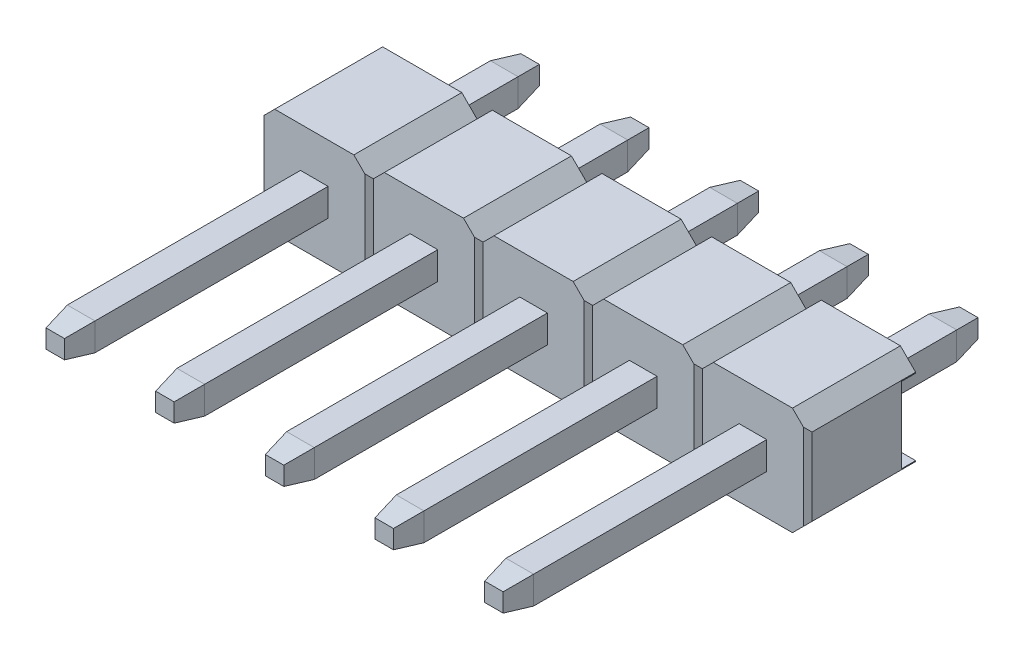
from build123d import *
from OCP.BRepFilletAPI import BRepFilletAPI_MakeChamfer

# Parameters (mm, degrees)
EXTRUDE1_DEPTH          = 1.25
CUT_EXTRUDE3_DEPTH      = 3.176671771
LPATTERN4_COUNT         = 5
LPATTERN4_PITCH         = 2.54
CUT_EXTRUDE1_DEPTH      = 12.565893826
CUT_EXTRUDE1_DEPTH_BACK = 12.565893826
SKETCH2_W               = 1.752893218
SKETCH2_H               = 0.33
SKETCH3_W               = 11
SKETCH3_H               = 0.64
EXTRUDE_THIN1_DEPTH     = 0.32
LPATTERN5_COUNT         = 5
LPATTERN5_PITCH         = 2.54
CHAMFER2_SIZE           = 0.6
CHAMFER2_SIZE2          = 0.105796188


with BuildPart() as part:
    # Sketch1 → Extrude1 (new, symmetric)
    with BuildSketch(Plane.XY):
        Polygon((-1.27, 0.896446609), (-0.916446609, 1.25), (0.916446609, 1.25), (1.27, 0.896446609), (1.27, -0.896446609), (0.916446609, -1.25), (-0.916446609, -1.25), (-1.27, -0.896446609), align=None)
    extrude1 = extrude(amount=EXTRUDE1_DEPTH, both=True)

    # Sketch4 → Cut-Extrude3 (cut, symmetric)
    with BuildSketch(Plane(origin=(0, 0, 0), x_dir=(1, 0, 0), z_dir=(0, 1, 0))):
        Polygon((-1.27, -1.15), (-1.17, -1.25), (-1.27, -1.25), align=None)
        Polygon((1.17, -1.25), (1.27, -1.15), (1.27, -1.25), align=None)
    cut_extrude3 = extrude(amount=CUT_EXTRUDE3_DEPTH, both=True, mode=Mode.SUBTRACT)

    # LPattern4: Extrude1, Cut-Extrude3 ×5
    with Locations(*[(-i * LPATTERN4_PITCH, 0, 0) for i in range(1, LPATTERN4_COUNT)]):
        add(extrude1)
        add(cut_extrude3, mode=Mode.SUBTRACT)

    # Sketch2 → Cut-Extrude1 (cut, two sides: drawn at the far end of the back side and taken through both)
    with BuildSketch(Plane(origin=(0, 0, 0), x_dir=(0, -1, 0), z_dir=(1, 0, 0)).offset(-CUT_EXTRUDE1_DEPTH_BACK)):
        with Locations((0, 1.085)):
            Rectangle(SKETCH2_W, SKETCH2_H)
    extrude(amount=CUT_EXTRUDE1_DEPTH + CUT_EXTRUDE1_DEPTH_BACK, mode=Mode.SUBTRACT)

    # Sketch3 → Extrude-Thin1 (add, symmetric)
    with BuildSketch(Plane(origin=(0, 0, 0), x_dir=(0, 0, -1), z_dir=(1, 0, 0))):
        with Locations((-1.75, 0)):
            Rectangle(SKETCH3_W, SKETCH3_H)
    extrude_thin1 = extrude(amount=EXTRUDE_THIN1_DEPTH, both=True)

    # LPattern5: Extrude-Thin1 ×5
    with Locations(*[(-i * LPATTERN5_PITCH, 0, 0) for i in range(1, LPATTERN5_COUNT)]):
        add(extrude_thin1)

    # Chamfer2: one chamfer whose edges measure the first distance from different faces: ONE call of the kernel's chamfer builder (chamfer() names one face for all edges)
    chamfer2_edges_1 = [part.edges().sort_by_distance(p)[0] for p in [
        (0, -0.32, 7.25),
    ]]
    chamfer2_side_1 = [part.faces().sort_by_distance(p)[0] for p in [
        (0, -0.32, 4.25),
    ]]
    chamfer2_edges_2 = [part.edges().sort_by_distance(p)[0] for p in [
        (0, 0.32, -3.75),
    ]]
    chamfer2_side_2 = [part.faces().sort_by_distance(p)[0] for p in [
        (0, 0.32, -2.335),
    ]]
    chamfer2_edges_3 = [part.edges().sort_by_distance(p)[0] for p in [
        (-0.32, 0, 7.25),
    ]]
    chamfer2_side_3 = [part.faces().sort_by_distance(p)[0] for p in [
        (-0.32, 0, 4.25),
    ]]
    chamfer2_edges_4 = [part.edges().sort_by_distance(p)[0] for p in [
        (-0.32, 0, -3.75),
    ]]
    chamfer2_side_4 = [part.faces().sort_by_distance(p)[0] for p in [
        (-0.32, 0, -2.335),
    ]]
    chamfer2_edges_5 = [part.edges().sort_by_distance(p)[0] for p in [
        (0, -0.32, -3.75),
    ]]
    chamfer2_side_5 = [part.faces().sort_by_distance(p)[0] for p in [
        (0, -0.32, -2.335),
    ]]
    chamfer2_edges_6 = [part.edges().sort_by_distance(p)[0] for p in [
        (0.32, 0, -3.75),
    ]]
    chamfer2_side_6 = [part.faces().sort_by_distance(p)[0] for p in [
        (0.32, 0, -2.335),
    ]]
    chamfer2_edges_7 = [part.edges().sort_by_distance(p)[0] for p in [
        (0, 0.32, 7.25),
    ]]
    chamfer2_side_7 = [part.faces().sort_by_distance(p)[0] for p in [
        (0, 0.32, 4.25),
    ]]
    chamfer2_edges_8 = [part.edges().sort_by_distance(p)[0] for p in [
        (0.32, 0, 7.25),
    ]]
    chamfer2_side_8 = [part.faces().sort_by_distance(p)[0] for p in [
        (0.32, 0, 4.25),
    ]]
    chamfer2_edges_9 = [part.edges().sort_by_distance(p)[0] for p in [
        (-2.54, -0.32, 7.25),
    ]]
    chamfer2_side_9 = [part.faces().sort_by_distance(p)[0] for p in [
        (-2.54, -0.32, 4.25),
    ]]
    chamfer2_edges_10 = [part.edges().sort_by_distance(p)[0] for p in [
        (-2.54, 0.32, -3.75),
    ]]
    chamfer2_side_10 = [part.faces().sort_by_distance(p)[0] for p in [
        (-2.54, 0.32, -2.335),
    ]]
    chamfer2_edges_11 = [part.edges().sort_by_distance(p)[0] for p in [
        (-2.86, 0, -3.75),
    ]]
    chamfer2_side_11 = [part.faces().sort_by_distance(p)[0] for p in [
        (-2.86, 0, -2.335),
    ]]
    chamfer2_edges_12 = [part.edges().sort_by_distance(p)[0] for p in [
        (-2.86, 0, 7.25),
    ]]
    chamfer2_side_12 = [part.faces().sort_by_distance(p)[0] for p in [
        (-2.86, 0, 4.25),
    ]]
    chamfer2_edges_13 = [part.edges().sort_by_distance(p)[0] for p in [
        (-2.54, -0.32, -3.75),
    ]]
    chamfer2_side_13 = [part.faces().sort_by_distance(p)[0] for p in [
        (-2.54, -0.32, -2.335),
    ]]
    chamfer2_edges_14 = [part.edges().sort_by_distance(p)[0] for p in [
        (-2.22, 0, -3.75),
    ]]
    chamfer2_side_14 = [part.faces().sort_by_distance(p)[0] for p in [
        (-2.22, 0, -2.335),
    ]]
    chamfer2_edges_15 = [part.edges().sort_by_distance(p)[0] for p in [
        (-2.54, 0.32, 7.25),
    ]]
    chamfer2_side_15 = [part.faces().sort_by_distance(p)[0] for p in [
        (-2.54, 0.32, 4.25),
    ]]
    chamfer2_edges_16 = [part.edges().sort_by_distance(p)[0] for p in [
        (-2.22, 0, 7.25),
    ]]
    chamfer2_side_16 = [part.faces().sort_by_distance(p)[0] for p in [
        (-2.22, 0, 4.25),
    ]]
    chamfer2_edges_17 = [part.edges().sort_by_distance(p)[0] for p in [
        (-5.08, -0.32, 7.25),
    ]]
    chamfer2_side_17 = [part.faces().sort_by_distance(p)[0] for p in [
        (-5.08, -0.32, 4.25),
    ]]
    chamfer2_edges_18 = [part.edges().sort_by_distance(p)[0] for p in [
        (-5.08, 0.32, -3.75),
    ]]
    chamfer2_side_18 = [part.faces().sort_by_distance(p)[0] for p in [
        (-5.08, 0.32, -2.335),
    ]]
    chamfer2_edges_19 = [part.edges().sort_by_distance(p)[0] for p in [
        (-5.4, 0, -3.75),
    ]]
    chamfer2_side_19 = [part.faces().sort_by_distance(p)[0] for p in [
        (-5.4, 0, -2.335),
    ]]
    chamfer2_edges_20 = [part.edges().sort_by_distance(p)[0] for p in [
        (-5.4, 0, 7.25),
    ]]
    chamfer2_side_20 = [part.faces().sort_by_distance(p)[0] for p in [
        (-5.4, 0, 4.25),
    ]]
    chamfer2_edges_21 = [part.edges().sort_by_distance(p)[0] for p in [
        (-5.08, -0.32, -3.75),
    ]]
    chamfer2_side_21 = [part.faces().sort_by_distance(p)[0] for p in [
        (-5.08, -0.32, -2.335),
    ]]
    chamfer2_edges_22 = [part.edges().sort_by_distance(p)[0] for p in [
        (-4.76, 0, -3.75),
    ]]
    chamfer2_side_22 = [part.faces().sort_by_distance(p)[0] for p in [
        (-4.76, 0, -2.335),
    ]]
    chamfer2_edges_23 = [part.edges().sort_by_distance(p)[0] for p in [
        (-5.08, 0.32, 7.25),
    ]]
    chamfer2_side_23 = [part.faces().sort_by_distance(p)[0] for p in [
        (-5.08, 0.32, 4.25),
    ]]
    chamfer2_edges_24 = [part.edges().sort_by_distance(p)[0] for p in [
        (-4.76, 0, 7.25),
    ]]
    chamfer2_side_24 = [part.faces().sort_by_distance(p)[0] for p in [
        (-4.76, 0, 4.25),
    ]]
    chamfer2_edges_25 = [part.edges().sort_by_distance(p)[0] for p in [
        (-7.62, -0.32, 7.25),
    ]]
    chamfer2_side_25 = [part.faces().sort_by_distance(p)[0] for p in [
        (-7.62, -0.32, 4.25),
    ]]
    chamfer2_edges_26 = [part.edges().sort_by_distance(p)[0] for p in [
        (-7.62, 0.32, -3.75),
    ]]
    chamfer2_side_26 = [part.faces().sort_by_distance(p)[0] for p in [
        (-7.62, 0.32, -2.335),
    ]]
    chamfer2_edges_27 = [part.edges().sort_by_distance(p)[0] for p in [
        (-7.94, 0, -3.75),
    ]]
    chamfer2_side_27 = [part.faces().sort_by_distance(p)[0] for p in [
        (-7.94, 0, -2.335),
    ]]
    chamfer2_edges_28 = [part.edges().sort_by_distance(p)[0] for p in [
        (-7.94, 0, 7.25),
    ]]
    chamfer2_side_28 = [part.faces().sort_by_distance(p)[0] for p in [
        (-7.94, 0, 4.25),
    ]]
    chamfer2_edges_29 = [part.edges().sort_by_distance(p)[0] for p in [
        (-7.62, -0.32, -3.75),
    ]]
    chamfer2_side_29 = [part.faces().sort_by_distance(p)[0] for p in [
        (-7.62, -0.32, -2.335),
    ]]
    chamfer2_edges_30 = [part.edges().sort_by_distance(p)[0] for p in [
        (-7.3, 0, -3.75),
    ]]
    chamfer2_side_30 = [part.faces().sort_by_distance(p)[0] for p in [
        (-7.3, 0, -2.335),
    ]]
    chamfer2_edges_31 = [part.edges().sort_by_distance(p)[0] for p in [
        (-7.62, 0.32, 7.25),
    ]]
    chamfer2_side_31 = [part.faces().sort_by_distance(p)[0] for p in [
        (-7.62, 0.32, 4.25),
    ]]
    chamfer2_edges_32 = [part.edges().sort_by_distance(p)[0] for p in [
        (-7.3, 0, 7.25),
    ]]
    chamfer2_side_32 = [part.faces().sort_by_distance(p)[0] for p in [
        (-7.3, 0, 4.25),
    ]]
    chamfer2_edges_33 = [part.edges().sort_by_distance(p)[0] for p in [
        (-10.16, -0.32, 7.25),
    ]]
    chamfer2_side_33 = [part.faces().sort_by_distance(p)[0] for p in [
        (-10.16, -0.32, 4.25),
    ]]
    chamfer2_edges_34 = [part.edges().sort_by_distance(p)[0] for p in [
        (-10.16, 0.32, -3.75),
    ]]
    chamfer2_side_34 = [part.faces().sort_by_distance(p)[0] for p in [
        (-10.16, 0.32, -2.335),
    ]]
    chamfer2_edges_35 = [part.edges().sort_by_distance(p)[0] for p in [
        (-10.48, 0, -3.75),
    ]]
    chamfer2_side_35 = [part.faces().sort_by_distance(p)[0] for p in [
        (-10.48, 0, -2.335),
    ]]
    chamfer2_edges_36 = [part.edges().sort_by_distance(p)[0] for p in [
        (-10.48, 0, 7.25),
    ]]
    chamfer2_side_36 = [part.faces().sort_by_distance(p)[0] for p in [
        (-10.48, 0, 4.25),
    ]]
    chamfer2_edges_37 = [part.edges().sort_by_distance(p)[0] for p in [
        (-10.16, -0.32, -3.75),
    ]]
    chamfer2_side_37 = [part.faces().sort_by_distance(p)[0] for p in [
        (-10.16, -0.32, -2.335),
    ]]
    chamfer2_edges_38 = [part.edges().sort_by_distance(p)[0] for p in [
        (-9.84, 0, -3.75),
    ]]
    chamfer2_side_38 = [part.faces().sort_by_distance(p)[0] for p in [
        (-9.84, 0, -2.335),
    ]]
    chamfer2_edges_39 = [part.edges().sort_by_distance(p)[0] for p in [
        (-10.16, 0.32, 7.25),
    ]]
    chamfer2_side_39 = [part.faces().sort_by_distance(p)[0] for p in [
        (-10.16, 0.32, 4.25),
    ]]
    chamfer2_edges_40 = [part.edges().sort_by_distance(p)[0] for p in [
        (-9.84, 0, 7.25),
    ]]
    chamfer2_side_40 = [part.faces().sort_by_distance(p)[0] for p in [
        (-9.84, 0, 4.25),
    ]]
    chamfer2 = BRepFilletAPI_MakeChamfer(part.part.solid().wrapped)
    for e in chamfer2_edges_1:
        chamfer2.Add(CHAMFER2_SIZE, CHAMFER2_SIZE2, e.wrapped, chamfer2_side_1[0].wrapped)  # the first distance lies on this face
    for e in chamfer2_edges_2:
        chamfer2.Add(CHAMFER2_SIZE, CHAMFER2_SIZE2, e.wrapped, chamfer2_side_2[0].wrapped)  # the first distance lies on this face
    for e in chamfer2_edges_3:
        chamfer2.Add(CHAMFER2_SIZE, CHAMFER2_SIZE2, e.wrapped, chamfer2_side_3[0].wrapped)  # the first distance lies on this face
    for e in chamfer2_edges_4:
        chamfer2.Add(CHAMFER2_SIZE, CHAMFER2_SIZE2, e.wrapped, chamfer2_side_4[0].wrapped)  # the first distance lies on this face
    for e in chamfer2_edges_5:
        chamfer2.Add(CHAMFER2_SIZE, CHAMFER2_SIZE2, e.wrapped, chamfer2_side_5[0].wrapped)  # the first distance lies on this face
    for e in chamfer2_edges_6:
        chamfer2.Add(CHAMFER2_SIZE, CHAMFER2_SIZE2, e.wrapped, chamfer2_side_6[0].wrapped)  # the first distance lies on this face
    for e in chamfer2_edges_7:
        chamfer2.Add(CHAMFER2_SIZE, CHAMFER2_SIZE2, e.wrapped, chamfer2_side_7[0].wrapped)  # the first distance lies on this face
    for e in chamfer2_edges_8:
        chamfer2.Add(CHAMFER2_SIZE, CHAMFER2_SIZE2, e.wrapped, chamfer2_side_8[0].wrapped)  # the first distance lies on this face
    for e in chamfer2_edges_9:
        chamfer2.Add(CHAMFER2_SIZE, CHAMFER2_SIZE2, e.wrapped, chamfer2_side_9[0].wrapped)  # the first distance lies on this face
    for e in chamfer2_edges_10:
        chamfer2.Add(CHAMFER2_SIZE, CHAMFER2_SIZE2, e.wrapped, chamfer2_side_10[0].wrapped)  # the first distance lies on this face
    for e in chamfer2_edges_11:
        chamfer2.Add(CHAMFER2_SIZE, CHAMFER2_SIZE2, e.wrapped, chamfer2_side_11[0].wrapped)  # the first distance lies on this face
    for e in chamfer2_edges_12:
        chamfer2.Add(CHAMFER2_SIZE, CHAMFER2_SIZE2, e.wrapped, chamfer2_side_12[0].wrapped)  # the first distance lies on this face
    for e in chamfer2_edges_13:
        chamfer2.Add(CHAMFER2_SIZE, CHAMFER2_SIZE2, e.wrapped, chamfer2_side_13[0].wrapped)  # the first distance lies on this face
    for e in chamfer2_edges_14:
        chamfer2.Add(CHAMFER2_SIZE, CHAMFER2_SIZE2, e.wrapped, chamfer2_side_14[0].wrapped)  # the first distance lies on this face
    for e in chamfer2_edges_15:
        chamfer2.Add(CHAMFER2_SIZE, CHAMFER2_SIZE2, e.wrapped, chamfer2_side_15[0].wrapped)  # the first distance lies on this face
    for e in chamfer2_edges_16:
        chamfer2.Add(CHAMFER2_SIZE, CHAMFER2_SIZE2, e.wrapped, chamfer2_side_16[0].wrapped)  # the first distance lies on this face
    for e in chamfer2_edges_17:
        chamfer2.Add(CHAMFER2_SIZE, CHAMFER2_SIZE2, e.wrapped, chamfer2_side_17[0].wrapped)  # the first distance lies on this face
    for e in chamfer2_edges_18:
        chamfer2.Add(CHAMFER2_SIZE, CHAMFER2_SIZE2, e.wrapped, chamfer2_side_18[0].wrapped)  # the first distance lies on this face
    for e in chamfer2_edges_19:
        chamfer2.Add(CHAMFER2_SIZE, CHAMFER2_SIZE2, e.wrapped, chamfer2_side_19[0].wrapped)  # the first distance lies on this face
    for e in chamfer2_edges_20:
        chamfer2.Add(CHAMFER2_SIZE, CHAMFER2_SIZE2, e.wrapped, chamfer2_side_20[0].wrapped)  # the first distance lies on this face
    for e in chamfer2_edges_21:
        chamfer2.Add(CHAMFER2_SIZE, CHAMFER2_SIZE2, e.wrapped, chamfer2_side_21[0].wrapped)  # the first distance lies on this face
    for e in chamfer2_edges_22:
        chamfer2.Add(CHAMFER2_SIZE, CHAMFER2_SIZE2, e.wrapped, chamfer2_side_22[0].wrapped)  # the first distance lies on this face
    for e in chamfer2_edges_23:
        chamfer2.Add(CHAMFER2_SIZE, CHAMFER2_SIZE2, e.wrapped, chamfer2_side_23[0].wrapped)  # the first distance lies on this face
    for e in chamfer2_edges_24:
        chamfer2.Add(CHAMFER2_SIZE, CHAMFER2_SIZE2, e.wrapped, chamfer2_side_24[0].wrapped)  # the first distance lies on this face
    for e in chamfer2_edges_25:
        chamfer2.Add(CHAMFER2_SIZE, CHAMFER2_SIZE2, e.wrapped, chamfer2_side_25[0].wrapped)  # the first distance lies on this face
    for e in chamfer2_edges_26:
        chamfer2.Add(CHAMFER2_SIZE, CHAMFER2_SIZE2, e.wrapped, chamfer2_side_26[0].wrapped)  # the first distance lies on this face
    for e in chamfer2_edges_27:
        chamfer2.Add(CHAMFER2_SIZE, CHAMFER2_SIZE2, e.wrapped, chamfer2_side_27[0].wrapped)  # the first distance lies on this face
    for e in chamfer2_edges_28:
        chamfer2.Add(CHAMFER2_SIZE, CHAMFER2_SIZE2, e.wrapped, chamfer2_side_28[0].wrapped)  # the first distance lies on this face
    for e in chamfer2_edges_29:
        chamfer2.Add(CHAMFER2_SIZE, CHAMFER2_SIZE2, e.wrapped, chamfer2_side_29[0].wrapped)  # the first distance lies on this face
    for e in chamfer2_edges_30:
        chamfer2.Add(CHAMFER2_SIZE, CHAMFER2_SIZE2, e.wrapped, chamfer2_side_30[0].wrapped)  # the first distance lies on this face
    for e in chamfer2_edges_31:
        chamfer2.Add(CHAMFER2_SIZE, CHAMFER2_SIZE2, e.wrapped, chamfer2_side_31[0].wrapped)  # the first distance lies on this face
    for e in chamfer2_edges_32:
        chamfer2.Add(CHAMFER2_SIZE, CHAMFER2_SIZE2, e.wrapped, chamfer2_side_32[0].wrapped)  # the first distance lies on this face
    for e in chamfer2_edges_33:
        chamfer2.Add(CHAMFER2_SIZE, CHAMFER2_SIZE2, e.wrapped, chamfer2_side_33[0].wrapped)  # the first distance lies on this face
    for e in chamfer2_edges_34:
        chamfer2.Add(CHAMFER2_SIZE, CHAMFER2_SIZE2, e.wrapped, chamfer2_side_34[0].wrapped)  # the first distance lies on this face
    for e in chamfer2_edges_35:
        chamfer2.Add(CHAMFER2_SIZE, CHAMFER2_SIZE2, e.wrapped, chamfer2_side_35[0].wrapped)  # the first distance lies on this face
    for e in chamfer2_edges_36:
        chamfer2.Add(CHAMFER2_SIZE, CHAMFER2_SIZE2, e.wrapped, chamfer2_side_36[0].wrapped)  # the first distance lies on this face
    for e in chamfer2_edges_37:
        chamfer2.Add(CHAMFER2_SIZE, CHAMFER2_SIZE2, e.wrapped, chamfer2_side_37[0].wrapped)  # the first distance lies on this face
    for e in chamfer2_edges_38:
        chamfer2.Add(CHAMFER2_SIZE, CHAMFER2_SIZE2, e.wrapped, chamfer2_side_38[0].wrapped)  # the first distance lies on this face
    for e in chamfer2_edges_39:
        chamfer2.Add(CHAMFER2_SIZE, CHAMFER2_SIZE2, e.wrapped, chamfer2_side_39[0].wrapped)  # the first distance lies on this face
    for e in chamfer2_edges_40:
        chamfer2.Add(CHAMFER2_SIZE, CHAMFER2_SIZE2, e.wrapped, chamfer2_side_40[0].wrapped)  # the first distance lies on this face
    add(Compound.cast(chamfer2.Shape()), mode=Mode.REPLACE)


solid = part.part
